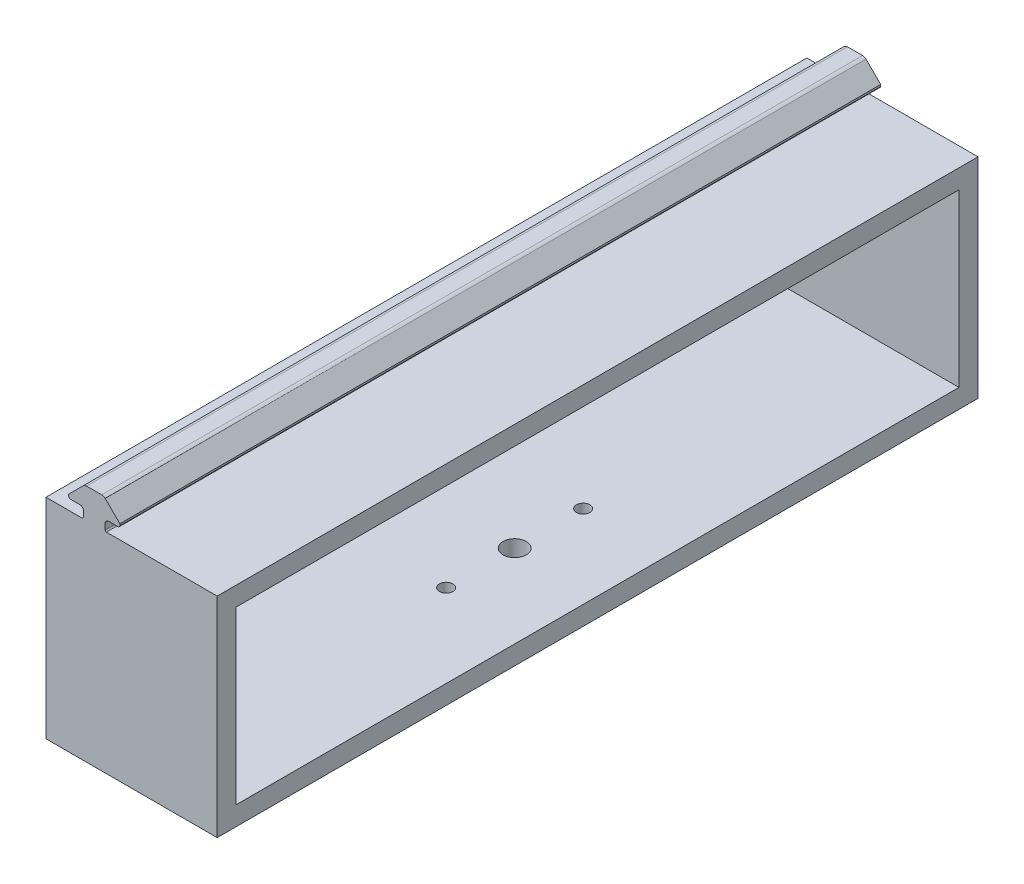
from build123d import *

# Parameters (mm, degrees)
BOSS_EXTRUDE1_DEPTH     = 200
CUT_EXTRUDE1_DEPTH      = 208.419799276
CUT_EXTRUDE1_DEPTH_BACK = 208.419799276
BODY_CUT_W              = 190
BODY_CUT_H              = 45
SCREW_HOLES_R           = 3.05778
SCREW_HOLES_R_2         = 1.7645
CUT_EXTRUDE9_DEPTH      = 10


with BuildPart() as part:
    # body sketch → Boss-Extrude1 (new body)
    with BuildSketch(Plane.XY):
        with BuildLine():
            Line((-11.792788403, 31.296564203), (-7.835417036, 31.296564203))
            ThreePointArc((-7.835417036, 31.296564203), (-7.367491329, 31.168035209), (-6.937848459, 30.94246665))
            Line((-6.937848459, 30.94246665), (-3.083381198, 27.087999388))
            Line((-3.083381198, 27.087999388), (-3.083381198, 26.62720762))
            ThreePointArc((-3.083381198, 26.62720762), (-3.247157606, 26.33019226), (-3.544172966, 26.166415852))
            Line((-3.544172966, 26.166415852), (-6.093887415, 26.166415852))
            ThreePointArc((-6.093887415, 26.166415852), (-6.684013327, 25.91258072), (-6.937848459, 25.322454808))
            Line((-6.937848459, 25.322454808), (-6.937848459, 23.771246138))
            ThreePointArc((-6.937848459, 23.771246138), (-6.853833412, 23.540250894), (-6.645828951, 23.409287254))
            Line((-6.645828951, 23.409287254), (22.5, 23.409287254))
            Line((22.5, 23.409287254), (22.5, -31.590712746))
            Line((22.5, -31.590712746), (-22.5, -31.590712746))
            Line((-22.5, -31.590712746), (-22.5, 23.409287254))
            Line((-22.5, 23.409287254), (-12.982376489, 23.409287254))
            ThreePointArc((-12.982376489, 23.409287254), (-12.774372027, 23.540250894), (-12.69035698, 23.771246138))
            Line((-12.69035698, 23.771246138), (-12.69035698, 25.322454808))
            ThreePointArc((-12.69035698, 25.322454808), (-12.944192112, 25.91258072), (-13.534318024, 26.166415852))
            Line((-13.534318024, 26.166415852), (-16.084032474, 26.166415852))
            ThreePointArc((-16.084032474, 26.166415852), (-16.381047834, 26.33019226), (-16.544824242, 26.62720762))
            Line((-16.544824242, 26.62720762), (-16.544824242, 27.087999388))
            Line((-16.544824242, 27.087999388), (-12.69035698, 30.94246665))
            ThreePointArc((-12.69035698, 30.94246665), (-12.260714111, 31.168035209), (-11.792788403, 31.296564203))
        make_face()
    extrude(amount=BOSS_EXTRUDE1_DEPTH)

    # body cut → Cut-Extrude1 (cut, two sides: drawn at the far end of the back side and taken through both)
    with BuildSketch(Plane(origin=(22.5, 0, 0), x_dir=(0, 0, -1), z_dir=(1, 0, 0)).offset(-CUT_EXTRUDE1_DEPTH_BACK)):
        with Locations((-100, -4.090712746)):
            Rectangle(BODY_CUT_W, BODY_CUT_H)
    extrude(amount=CUT_EXTRUDE1_DEPTH + CUT_EXTRUDE1_DEPTH_BACK, mode=Mode.SUBTRACT)

    # screw holes → Cut-Extrude9 (cut)
    with BuildSketch(Plane(origin=(0, -31.590712746, 0), x_dir=(-1, 0, 0), z_dir=(0, -1, 0))):
        with Locations(Location((-0.7, -100, 0), (0, 0, 90))):
            Circle(SCREW_HOLES_R)
        with Locations(Location((-0.696336872, -81.999941546, 0), (0, 0, 90))):
            Circle(SCREW_HOLES_R_2)
        with Locations(Location((-0.696336872, -117.999941546, 0), (0, 0, 90))):
            Circle(SCREW_HOLES_R_2)
    extrude(amount=-CUT_EXTRUDE9_DEPTH, mode=Mode.SUBTRACT)


solid = part.part
